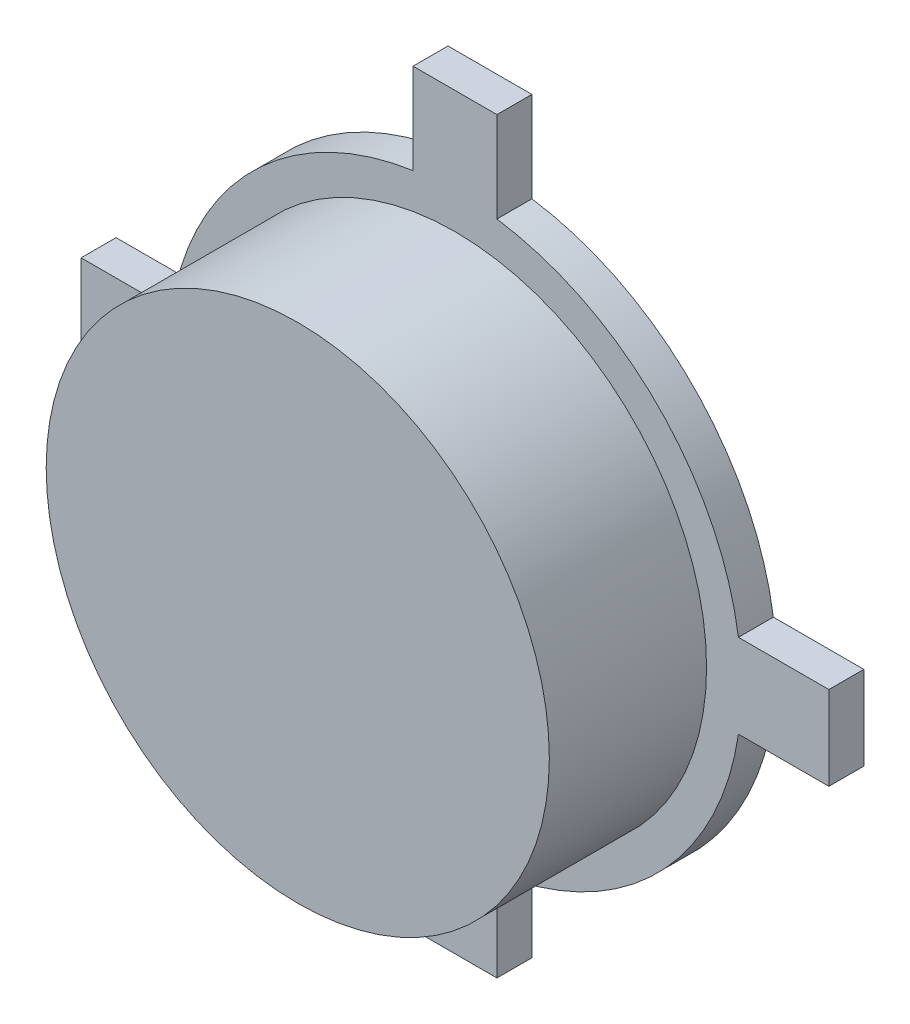
from build123d import *

# Parameters (mm, degrees)
SKETCH1_R           = 7.2
BOSS_EXTRUDE1_DEPTH = 4.5
BOSS_EXTRUDE3_DEPTH = 1


with BuildPart() as part:
    # Sketch1 → Boss-Extrude1 (new body)
    with BuildSketch(Plane.XY):
        Circle(SKETCH1_R)
    extrude(amount=BOSS_EXTRUDE1_DEPTH)

    # Sketch4 → Boss-Extrude3 (add)
    with BuildSketch(Plane(origin=(0, 0, 0), x_dir=(-1, 0, 0), z_dir=(0, 0, -1))):
        with BuildLine():
            Line((10.7, 1.2), (8.111719916, 1.2))
            ThreePointArc((8.111719916, 1.2), (5.798275606, 5.798275606), (1.2, 8.111719916))
            Line((1.2, 8.111719916), (1.2, 10.7))
            Line((1.2, 10.7), (-1.2, 10.7))
            Line((-1.2, 10.7), (-1.2, 8.111719916))
            ThreePointArc((-1.2, 8.111719916), (-5.798275606, 5.798275606), (-8.111719916, 1.2))
            Line((-8.111719916, 1.2), (-10.7, 1.2))
            Line((-10.7, 1.2), (-10.7, -1.2))
            Line((-10.7, -1.2), (-8.111719916, -1.2))
            ThreePointArc((-8.111719916, -1.2), (-5.798275606, -5.798275606), (-1.2, -8.111719916))
            Line((-1.2, -8.111719916), (-1.2, -10.7))
            Line((-1.2, -10.7), (1.2, -10.7))
            Line((1.2, -10.7), (1.2, -8.111719916))
            ThreePointArc((1.2, -8.111719916), (5.798275606, -5.798275606), (8.111719916, -1.2))
            Line((8.111719916, -1.2), (10.7, -1.2))
            Line((10.7, -1.2), (10.7, 1.2))
        make_face()
    extrude(amount=BOSS_EXTRUDE3_DEPTH)


solid = part.part
